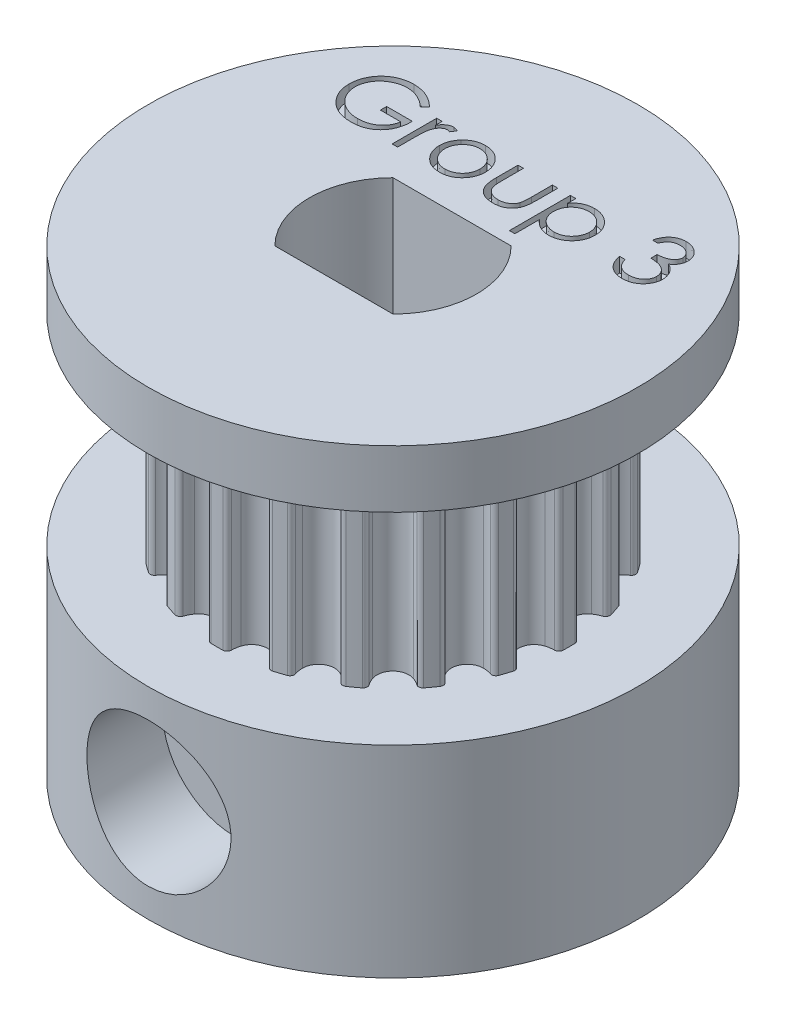
from build123d import *

# Parameters (mm, degrees)
GEAR_DEPTH              = 3.5
SKETCH2_R               = 8.5
BASE_DEPTH              = 7
NUT_PASSTHROUGH_DEPTH   = 4.2
TOP_START               = 2
SKETCH9_R               = 8.5
TOP_DEPTH               = 2
SHAFT_HOLE_DEPTH        = 16.016657418
SKETCH10_R              = 1.4
SCREW_HOLE_DEPTH        = 16.9608897
SCREW_START             = 5.5
SKETCH10_3_R            = 2.5
SKETCH10_3_R_2          = 1.4
SCREW_COUNTERBORE_DEPTH = 11.460889892
CUT_EXTRUDE2_DEPTH      = 0.5


with BuildPart() as part:
    # Sketch1 → Gear (new, symmetric)
    with BuildSketch(Plane(origin=(0, 0, 0), x_dir=(1, 0, 0), z_dir=(0, 1, 0))):
        with BuildLine():
            ThreePointArc((0.83678283, 5.283238861), (0.559451844, 5.412576285), (0.392824337, 5.669239329))
            ThreePointArc((0.392824337, 5.669239329), (0.360319412, 5.812613334), (0.349186496, 5.959203693))
            ThreePointArc((0.349186496, 5.959203693), (0.306893857, 6.063268803), (0.204198113, 6.108785816))
            ThreePointArc((0.204198113, 6.108785816), (0, 6.112197724), (-0.204198113, 6.108785816))
            ThreePointArc((-0.204198113, 6.108785816), (-0.306893857, 6.063268803), (-0.349186496, 5.959203693))
            ThreePointArc((-0.349186496, 5.959203693), (-0.360319412, 5.812613334), (-0.392824337, 5.669239329))
            ThreePointArc((-0.392824337, 5.669239329), (-0.559451844, 5.412576285), (-0.83678283, 5.283238861))
            ThreePointArc((-0.83678283, 5.283238861), (-1.140507733, 5.320546073), (-1.378293153, 5.513156403))
            ThreePointArc((-1.378293153, 5.513156403), (-1.453512177, 5.63946861), (-1.509399121, 5.775444066))
            ThreePointArc((-1.509399121, 5.775444066), (-1.581779699, 5.861346723), (-1.693514686, 5.872901244))
            ThreePointArc((-1.693514686, 5.872901244), (-1.88877297, 5.813045474), (-2.081922578, 5.74669987))
            ThreePointArc((-2.081922578, 5.74669987), (-2.165526505, 5.671675888), (-2.173591307, 5.559634943))
            ThreePointArc((-2.173591307, 5.559634943), (-2.138880426, 5.416778966), (-2.125489443, 5.270377611))
            ThreePointArc((-2.125489443, 5.270377611), (-2.204648378, 4.974785818), (-2.428438357, 4.766078631))
            ThreePointArc((-2.428438357, 4.766078631), (-2.728826467, 4.707703741), (-3.014493705, 4.817407315))
            ThreePointArc((-3.014493705, 4.817407315), (-3.125063867, 4.914293405), (-3.220234237, 5.026343734))
            ThreePointArc((-3.220234237, 5.026343734), (-3.315617637, 5.085675187), (-3.425454468, 5.062136179))
            ThreePointArc((-3.425454468, 5.062136179), (-3.592659681, 4.944871831), (-3.755853956, 4.822086901))
            ThreePointArc((-3.755853956, 4.822086901), (-3.812182329, 4.72489982), (-3.785229856, 4.615850388))
            ThreePointArc((-3.785229856, 4.615850388), (-3.708072922, 4.490712533), (-3.650096834, 4.355614611))
            ThreePointArc((-3.650096834, 4.355614611), (-3.634038567, 4.050028654), (-3.782381417, 3.782381417))
            ThreePointArc((-3.782381417, 3.782381417), (-4.050028654, 3.634038567), (-4.355614611, 3.650096834))
            ThreePointArc((-4.355614611, 3.650096834), (-4.490712533, 3.708072922), (-4.615850388, 3.785229856))
            ThreePointArc((-4.615850388, 3.785229856), (-4.72489982, 3.812182329), (-4.822086901, 3.755853956))
            ThreePointArc((-4.822086901, 3.755853956), (-4.944871831, 3.592659681), (-5.062136179, 3.425454468))
            ThreePointArc((-5.062136179, 3.425454468), (-5.085675187, 3.315617637), (-5.026343734, 3.220234237))
            ThreePointArc((-5.026343734, 3.220234237), (-4.914293405, 3.125063867), (-4.817407315, 3.014493705))
            ThreePointArc((-4.817407315, 3.014493705), (-4.707703741, 2.728826467), (-4.766078631, 2.428438357))
            ThreePointArc((-4.766078631, 2.428438357), (-4.974785818, 2.204648378), (-5.270377611, 2.125489443))
            ThreePointArc((-5.270377611, 2.125489443), (-5.416778966, 2.138880426), (-5.559634943, 2.173591307))
            ThreePointArc((-5.559634943, 2.173591307), (-5.671675888, 2.165526505), (-5.74669987, 2.081922578))
            ThreePointArc((-5.74669987, 2.081922578), (-5.813045474, 1.88877297), (-5.872901244, 1.693514686))
            ThreePointArc((-5.872901244, 1.693514686), (-5.861346723, 1.581779699), (-5.775444066, 1.509399121))
            ThreePointArc((-5.775444066, 1.509399121), (-5.63946861, 1.453512177), (-5.513156403, 1.378293153))
            ThreePointArc((-5.513156403, 1.378293153), (-5.320546073, 1.140507733), (-5.283238861, 0.83678283))
            ThreePointArc((-5.283238861, 0.83678283), (-5.412576285, 0.559451844), (-5.669239329, 0.392824337))
            ThreePointArc((-5.669239329, 0.392824337), (-5.812613334, 0.360319412), (-5.959203693, 0.349186496))
            ThreePointArc((-5.959203693, 0.349186496), (-6.063268803, 0.306893857), (-6.108785816, 0.204198113))
            ThreePointArc((-6.108785816, 0.204198113), (-6.112197724, 0), (-6.108785816, -0.204198113))
            ThreePointArc((-6.108785816, -0.204198113), (-6.063268803, -0.306893857), (-5.959203693, -0.349186496))
            ThreePointArc((-5.959203693, -0.349186496), (-5.812613334, -0.360319412), (-5.669239329, -0.392824337))
            ThreePointArc((-5.669239329, -0.392824337), (-5.412576285, -0.559451844), (-5.283238861, -0.83678283))
            ThreePointArc((-5.283238861, -0.83678283), (-5.320546073, -1.140507733), (-5.513156403, -1.378293153))
            ThreePointArc((-5.513156403, -1.378293153), (-5.63946861, -1.453512177), (-5.775444066, -1.509399121))
            ThreePointArc((-5.775444066, -1.509399121), (-5.861346723, -1.581779699), (-5.872901244, -1.693514686))
            ThreePointArc((-5.872901244, -1.693514686), (-5.813045474, -1.88877297), (-5.74669987, -2.081922578))
            ThreePointArc((-5.74669987, -2.081922578), (-5.671675888, -2.165526505), (-5.559634943, -2.173591307))
            ThreePointArc((-5.559634943, -2.173591307), (-5.416778966, -2.138880426), (-5.270377611, -2.125489443))
            ThreePointArc((-5.270377611, -2.125489443), (-4.974785818, -2.204648378), (-4.766078631, -2.428438357))
            ThreePointArc((-4.766078631, -2.428438357), (-4.707703741, -2.728826467), (-4.817407315, -3.014493705))
            ThreePointArc((-4.817407315, -3.014493705), (-4.914293405, -3.125063867), (-5.026343734, -3.220234237))
            ThreePointArc((-5.026343734, -3.220234237), (-5.085675187, -3.315617637), (-5.062136179, -3.425454468))
            ThreePointArc((-5.062136179, -3.425454468), (-4.944871831, -3.592659681), (-4.822086901, -3.755853956))
            ThreePointArc((-4.822086901, -3.755853956), (-4.72489982, -3.812182329), (-4.615850388, -3.785229856))
            ThreePointArc((-4.615850388, -3.785229856), (-4.490712533, -3.708072922), (-4.355614611, -3.650096834))
            ThreePointArc((-4.355614611, -3.650096834), (-4.050028654, -3.634038567), (-3.782381417, -3.782381417))
            ThreePointArc((-3.782381417, -3.782381417), (-3.634038567, -4.050028654), (-3.650096834, -4.355614611))
            ThreePointArc((-3.650096834, -4.355614611), (-3.708072922, -4.490712533), (-3.785229856, -4.615850388))
            ThreePointArc((-3.785229856, -4.615850388), (-3.812182329, -4.72489982), (-3.755853956, -4.822086901))
            ThreePointArc((-3.755853956, -4.822086901), (-3.592659681, -4.944871831), (-3.425454468, -5.062136179))
            ThreePointArc((-3.425454468, -5.062136179), (-3.315617637, -5.085675187), (-3.220234237, -5.026343734))
            ThreePointArc((-3.220234237, -5.026343734), (-3.125063867, -4.914293405), (-3.014493705, -4.817407315))
            ThreePointArc((-3.014493705, -4.817407315), (-2.728826467, -4.707703741), (-2.428438357, -4.766078631))
            ThreePointArc((-2.428438357, -4.766078631), (-2.204648378, -4.974785818), (-2.125489443, -5.270377611))
            ThreePointArc((-2.125489443, -5.270377611), (-2.138880426, -5.416778966), (-2.173591307, -5.559634943))
            ThreePointArc((-2.173591307, -5.559634943), (-2.165526505, -5.671675888), (-2.081922578, -5.74669987))
            ThreePointArc((-2.081922578, -5.74669987), (-1.88877297, -5.813045474), (-1.693514686, -5.872901244))
            ThreePointArc((-1.693514686, -5.872901244), (-1.581779699, -5.861346723), (-1.509399121, -5.775444066))
            ThreePointArc((-1.509399121, -5.775444066), (-1.453512177, -5.63946861), (-1.378293153, -5.513156403))
            ThreePointArc((-1.378293153, -5.513156403), (-1.140507733, -5.320546073), (-0.83678283, -5.283238861))
            ThreePointArc((-0.83678283, -5.283238861), (-0.559451844, -5.412576285), (-0.392824337, -5.669239329))
            ThreePointArc((-0.392824337, -5.669239329), (-0.360319412, -5.812613334), (-0.349186496, -5.959203693))
            ThreePointArc((-0.349186496, -5.959203693), (-0.306893857, -6.063268803), (-0.204198113, -6.108785816))
            ThreePointArc((-0.204198113, -6.108785816), (0, -6.112197724), (0.204198113, -6.108785816))
            ThreePointArc((0.204198113, -6.108785816), (0.306893857, -6.063268803), (0.349186496, -5.959203693))
            ThreePointArc((0.349186496, -5.959203693), (0.360319412, -5.812613334), (0.392824337, -5.669239329))
            ThreePointArc((0.392824337, -5.669239329), (0.559451844, -5.412576285), (0.83678283, -5.283238861))
            ThreePointArc((0.83678283, -5.283238861), (1.140507733, -5.320546073), (1.378293153, -5.513156403))
            ThreePointArc((1.378293153, -5.513156403), (1.453512177, -5.63946861), (1.509399121, -5.775444066))
            ThreePointArc((1.509399121, -5.775444066), (1.581779699, -5.861346723), (1.693514686, -5.872901244))
            ThreePointArc((1.693514686, -5.872901244), (1.88877297, -5.813045474), (2.081922578, -5.74669987))
            ThreePointArc((2.081922578, -5.74669987), (2.165526505, -5.671675888), (2.173591307, -5.559634943))
            ThreePointArc((2.173591307, -5.559634943), (2.138880426, -5.416778966), (2.125489443, -5.270377611))
            ThreePointArc((2.125489443, -5.270377611), (2.204648378, -4.974785818), (2.428438357, -4.766078631))
            ThreePointArc((2.428438357, -4.766078631), (2.728826467, -4.707703741), (3.014493705, -4.817407315))
            ThreePointArc((3.014493705, -4.817407315), (3.125063867, -4.914293405), (3.220234237, -5.026343734))
            ThreePointArc((3.220234237, -5.026343734), (3.315617637, -5.085675187), (3.425454468, -5.062136179))
            ThreePointArc((3.425454468, -5.062136179), (3.592659681, -4.944871831), (3.755853956, -4.822086901))
            ThreePointArc((3.755853956, -4.822086901), (3.812182329, -4.72489982), (3.785229856, -4.615850388))
            ThreePointArc((3.785229856, -4.615850388), (3.708072922, -4.490712533), (3.650096834, -4.355614611))
            ThreePointArc((3.650096834, -4.355614611), (3.634038567, -4.050028654), (3.782381417, -3.782381417))
            ThreePointArc((3.782381417, -3.782381417), (4.050028654, -3.634038567), (4.355614611, -3.650096834))
            ThreePointArc((4.355614611, -3.650096834), (4.490712533, -3.708072922), (4.615850388, -3.785229856))
            ThreePointArc((4.615850388, -3.785229856), (4.72489982, -3.812182329), (4.822086901, -3.755853956))
            ThreePointArc((4.822086901, -3.755853956), (4.944871831, -3.592659681), (5.062136179, -3.425454468))
            ThreePointArc((5.062136179, -3.425454468), (5.085675187, -3.315617637), (5.026343734, -3.220234237))
            ThreePointArc((5.026343734, -3.220234237), (4.914293405, -3.125063867), (4.817407315, -3.014493705))
            ThreePointArc((4.817407315, -3.014493705), (4.707703741, -2.728826467), (4.766078631, -2.428438357))
            ThreePointArc((4.766078631, -2.428438357), (4.974785818, -2.204648378), (5.270377611, -2.125489443))
            ThreePointArc((5.270377611, -2.125489443), (5.416778966, -2.138880426), (5.559634943, -2.173591307))
            ThreePointArc((5.559634943, -2.173591307), (5.671675888, -2.165526505), (5.74669987, -2.081922578))
            ThreePointArc((5.74669987, -2.081922578), (5.813045474, -1.88877297), (5.872901244, -1.693514686))
            ThreePointArc((5.872901244, -1.693514686), (5.861346723, -1.581779699), (5.775444066, -1.509399121))
            ThreePointArc((5.775444066, -1.509399121), (5.63946861, -1.453512177), (5.513156403, -1.378293153))
            ThreePointArc((5.513156403, -1.378293153), (5.320546073, -1.140507733), (5.283238861, -0.83678283))
            ThreePointArc((5.283238861, -0.83678283), (5.412576285, -0.559451844), (5.669239329, -0.392824337))
            ThreePointArc((5.669239329, -0.392824337), (5.812613334, -0.360319412), (5.959203693, -0.349186496))
            ThreePointArc((5.959203693, -0.349186496), (6.063268803, -0.306893857), (6.108785816, -0.204198113))
            ThreePointArc((6.108785816, -0.204198113), (6.112197724, 0), (6.108785816, 0.204198113))
            ThreePointArc((6.108785816, 0.204198113), (6.063268803, 0.306893857), (5.959203693, 0.349186496))
            ThreePointArc((5.959203693, 0.349186496), (5.812613334, 0.360319412), (5.669239329, 0.392824337))
            ThreePointArc((5.669239329, 0.392824337), (5.412576285, 0.559451844), (5.283238861, 0.83678283))
            ThreePointArc((5.283238861, 0.83678283), (5.320546073, 1.140507733), (5.513156403, 1.378293153))
            ThreePointArc((5.513156403, 1.378293153), (5.63946861, 1.453512177), (5.775444066, 1.509399121))
            ThreePointArc((5.775444066, 1.509399121), (5.861346723, 1.581779699), (5.872901244, 1.693514686))
            ThreePointArc((5.872901244, 1.693514686), (5.813045474, 1.88877297), (5.74669987, 2.081922578))
            ThreePointArc((5.74669987, 2.081922578), (5.671675888, 2.165526505), (5.559634943, 2.173591307))
            ThreePointArc((5.559634943, 2.173591307), (5.416778966, 2.138880426), (5.270377611, 2.125489443))
            ThreePointArc((5.270377611, 2.125489443), (4.974785818, 2.204648378), (4.766078631, 2.428438357))
            ThreePointArc((4.766078631, 2.428438357), (4.707703741, 2.728826467), (4.817407315, 3.014493705))
            ThreePointArc((4.817407315, 3.014493705), (4.914293405, 3.125063867), (5.026343734, 3.220234237))
            ThreePointArc((5.026343734, 3.220234237), (5.085675187, 3.315617637), (5.062136179, 3.425454468))
            ThreePointArc((5.062136179, 3.425454468), (4.944871831, 3.592659681), (4.822086901, 3.755853956))
            ThreePointArc((4.822086901, 3.755853956), (4.72489982, 3.812182329), (4.615850388, 3.785229856))
            ThreePointArc((4.615850388, 3.785229856), (4.490712533, 3.708072922), (4.355614611, 3.650096834))
            ThreePointArc((4.355614611, 3.650096834), (4.050028654, 3.634038567), (3.782381417, 3.782381417))
            ThreePointArc((3.782381417, 3.782381417), (3.634038567, 4.050028654), (3.650096834, 4.355614611))
            ThreePointArc((3.650096834, 4.355614611), (3.708072922, 4.490712533), (3.785229856, 4.615850388))
            ThreePointArc((3.785229856, 4.615850388), (3.812182329, 4.72489982), (3.755853956, 4.822086901))
            ThreePointArc((3.755853956, 4.822086901), (3.592659681, 4.944871831), (3.425454468, 5.062136179))
            ThreePointArc((3.425454468, 5.062136179), (3.315617637, 5.085675187), (3.220234237, 5.026343734))
            ThreePointArc((3.220234237, 5.026343734), (3.125063867, 4.914293405), (3.014493705, 4.817407315))
            ThreePointArc((3.014493705, 4.817407315), (2.728826467, 4.707703741), (2.428438357, 4.766078631))
            ThreePointArc((2.428438357, 4.766078631), (2.204648378, 4.974785818), (2.125489443, 5.270377611))
            ThreePointArc((2.125489443, 5.270377611), (2.138880426, 5.416778966), (2.173591307, 5.559634943))
            ThreePointArc((2.173591307, 5.559634943), (2.165526505, 5.671675888), (2.081922578, 5.74669987))
            ThreePointArc((2.081922578, 5.74669987), (1.88877297, 5.813045474), (1.693514686, 5.872901244))
            ThreePointArc((1.693514686, 5.872901244), (1.581779699, 5.861346723), (1.509399121, 5.775444066))
            ThreePointArc((1.509399121, 5.775444066), (1.453512177, 5.63946861), (1.378293153, 5.513156403))
            ThreePointArc((1.378293153, 5.513156403), (1.140507733, 5.320546073), (0.83678283, 5.283238861))
        make_face()
    extrude(amount=GEAR_DEPTH, both=True)

    # Sketch2 → Base (add)
    with BuildSketch(Plane.XZ.offset(3.5)):
        Circle(SKETCH2_R)
        with BuildLine():
            ThreePointArc((2.05121915, 2.05), (2.9, 0), (2.05121915, -2.05))
            Line((2.05121915, -2.05), (-2.05121915, -2.05))
            ThreePointArc((-2.05121915, -2.05), (-2.9, 0), (-2.05121915, 2.05))
            Line((-2.05121915, 2.05), (2.05121915, 2.05))
        make_face(mode=Mode.SUBTRACT)
    extrude(amount=BASE_DEPTH)

    # Sketch3 → Nut Passthrough (cut)
    with BuildSketch(Plane.XY):
        Polygon((-2.65, -5.470021787), (-2.65, -10.5), (2.65, -10.5), (2.65, -5.470021787), (0, -3.940043573), align=None)
    extrude(amount=NUT_PASSTHROUGH_DEPTH, mode=Mode.SUBTRACT)

    # Sketch9 → Top (add)
    with BuildSketch(Plane(origin=(0, 3.5, 0), x_dir=(1, 0, 0), z_dir=(0, 1, 0)).offset(TOP_START)):
        Circle(SKETCH9_R)
    extrude(amount=-TOP_DEPTH)

    # Sketch2<4> → Shaft Hole (cut, through all)
    with BuildSketch(Plane.XZ.offset(3.5)):
        with BuildLine():
            ThreePointArc((-2.05121915, 2.05), (-2.9, 0), (-2.05121915, -2.05))
            Line((-2.05121915, -2.05), (2.05121915, -2.05))
            ThreePointArc((2.05121915, -2.05), (2.9, 0), (2.05121915, 2.05))
            Line((2.05121915, 2.05), (-2.05121915, 2.05))
        make_face()
    extrude(amount=-SHAFT_HOLE_DEPTH, mode=Mode.SUBTRACT)

    # Sketch10 → Screw Hole (cut, through all)
    with BuildSketch(Plane.XY):
        with Locations((0, -7)):
            Circle(SKETCH10_R)
    extrude(amount=SCREW_HOLE_DEPTH, mode=Mode.SUBTRACT)

    # Sketch10<3> → Screw Counterbore (cut, through all)
    with BuildSketch(Plane.XY.offset(SCREW_START)):
        with Locations((0, -7)):
            Circle(SKETCH10_3_R)
        with Locations((0, -7)):
            Circle(SKETCH10_3_R_2, mode=Mode.SUBTRACT)
    extrude(amount=SCREW_COUNTERBORE_DEPTH, mode=Mode.SUBTRACT)

    # Sketch20 → Cut-Extrude2 (cut)
    # profile 1 of 6: a face of its own
    with BuildSketch(Plane(origin=(0, 5.5, 0), x_dir=(1, 0, 0), z_dir=(0, 1, 0))):
        with BuildLine():
            Line((-3.541346154, 4.805408654), (-3.704166667, 4.651068376))
            add(Edge.make_bspline(
                [(-3.704166667, 4.651068376), (-3.733629994, 4.678785136), (-3.79185408, 4.733557734), (-3.886777655, 4.804623907), (-3.985815662, 4.86550293), (-4.088451315, 4.915036701), (-4.192142917, 4.954559561), (-4.295514129, 4.982698008), (-4.397504624, 5.000642828), (-4.465339085, 5.002788747), (-4.49876469, 5.003846154)],
                knots=[0, 0, 0, 0, 1.08915593, 2.152340314, 3.188132944, 4.216796309, 5.218260357, 6.173443236, 7.099959455, 8, 8, 8, 8], degree=3))
            add(Edge.make_bspline(
                [(-4.49876469, 5.003846154), (-4.519275009, 5.003596021), (-4.560242451, 5.003096403), (-4.62109477, 4.996719664), (-4.681308879, 4.987548532), (-4.74077111, 4.97427892), (-4.799597079, 4.95746106), (-4.85758219, 4.936424137), (-4.914834609, 4.91189787), (-4.970815049, 4.883557231), (-5.025086686, 4.852424181), (-5.076344392, 4.817923397), (-5.124914876, 4.781160653), (-5.169885228, 4.741215537), (-5.211514127, 4.69844988), (-5.250792428, 4.653659214), (-5.286338697, 4.60561982), (-5.318446212, 4.55521556), (-5.347088714, 4.503331713), (-5.372372995, 4.450467666), (-5.393598377, 4.396798764), (-5.410392286, 4.34225766), (-5.424247776, 4.287266303), (-5.433995091, 4.231443925), (-5.439490394, 4.174730753), (-5.440440947, 4.136753363), (-5.440918803, 4.117661592)],
                knots=[0, 0, 0, 0, 1.02818874, 2.053710826, 3.065248034, 4.081641283, 5.106893873, 6.131558223, 7.173050175, 8.228653731, 9.27666206, 10.308777013, 11.325269123, 12.329503258, 13.32196095, 14.316845687, 15.314881793, 16.315733098, 17.311955233, 18.285320748, 19.252783886, 20.203351036, 21.145449891, 22.095197417, 23.042428769, 24, 24, 24, 24], degree=3))
            add(Edge.make_bspline(
                [(-5.440918803, 4.117661592), (-5.440461774, 4.098145431), (-5.439548963, 4.059166401), (-5.433706769, 4.000991891), (-5.422864452, 3.943681386), (-5.408369695, 3.887046562), (-5.39023844, 3.830990427), (-5.367636875, 3.775756004), (-5.340866726, 3.721345339), (-5.309880812, 3.668248685), (-5.275901536, 3.616527618), (-5.237835959, 3.567808288), (-5.197401225, 3.521441933), (-5.153124247, 3.478458018), (-5.10642481, 3.437706805), (-5.055907671, 3.400311037), (-5.002566183, 3.365550397), (-4.946318965, 3.333862978), (-4.88777633, 3.305554959), (-4.827749627, 3.280382412), (-4.766047091, 3.259651575), (-4.702992988, 3.242755674), (-4.638662485, 3.228906447), (-4.572729043, 3.219996804), (-4.505677453, 3.213531396), (-4.460478375, 3.213058672), (-4.437706998, 3.212820513)],
                knots=[0, 0, 0, 0, 0.93586088, 1.869166235, 2.799637598, 3.729985548, 4.670839027, 5.622275134, 6.589130586, 7.576015415, 8.568469353, 9.55398029, 10.53834874, 11.515998671, 12.510579167, 13.508179873, 14.527009472, 15.561807829, 16.601455013, 17.643573243, 18.680854198, 19.719860599, 20.772568776, 21.833555941, 22.908541556, 24, 24, 24, 24], degree=3))
            add(Edge.make_bspline(
                [(-4.437706998, 3.212820513), (-4.410263902, 3.213394176), (-4.356374925, 3.214520656), (-4.277159315, 3.223289878), (-4.20107841, 3.236985796), (-4.128345992, 3.257043267), (-4.058877584, 3.282626918), (-3.992418519, 3.313466985), (-3.92949204, 3.350746359), (-3.869908978, 3.392821984), (-3.81502249, 3.439700001), (-3.765520234, 3.490284981), (-3.722191771, 3.544331384), (-3.68439131, 3.601520884), (-3.653119886, 3.662326854), (-3.6274521, 3.726451308), (-3.607777205, 3.793923089), (-3.599700625, 3.840545172), (-3.595619658, 3.864102564)],
                knots=[0, 0, 0, 0, 1.13008108, 2.219097802, 3.278683437, 4.311054135, 5.322181354, 6.324827112, 7.324222904, 8.330512327, 9.32562643, 10.293043162, 11.24128371, 12.174520618, 13.111833804, 14.052305215, 15.015860969, 16, 16, 16, 16], degree=3))
            Line((-3.595619658, 3.864102564), (-4.301175214, 3.864102564))
            Line((-4.301175214, 3.864102564), (-4.301175214, 4.081196581))
            Line((-4.301175214, 4.081196581), (-3.405662393, 4.081196581))
            add(Edge.make_bspline(
                [(-3.405662393, 4.081196581), (-3.406694025, 4.040733481), (-3.408713116, 3.961539884), (-3.422875984, 3.846048339), (-3.44574597, 3.736966411), (-3.476988158, 3.63417922), (-3.51743178, 3.537832428), (-3.566642786, 3.447828214), (-3.625408783, 3.36474803), (-3.691636526, 3.287913633), (-3.765961738, 3.219376443), (-3.846376094, 3.159138566), (-3.933012451, 3.10839746), (-4.025788859, 3.067116012), (-4.124401597, 3.03489793), (-4.229078855, 3.012055119), (-4.33967868, 2.998369379), (-4.415477528, 2.996620783), (-4.454243456, 2.995726496)],
                knots=[0, 0, 0, 0, 1.140356446, 2.231883559, 3.274166699, 4.278491846, 5.25512956, 6.21435461, 7.1637429, 8.11826594, 9.068280886, 10.0076534, 10.945064095, 11.891975133, 12.864533718, 13.863980011, 14.907571808, 16, 16, 16, 16], degree=3))
            add(Edge.make_bspline(
                [(-4.454243456, 2.995726496), (-4.478137681, 2.996070679), (-4.525264793, 2.996749518), (-4.594867402, 3.001573914), (-4.662550915, 3.009000739), (-4.728305473, 3.020216123), (-4.792372947, 3.03395308), (-4.854433362, 3.05154362), (-4.91472313, 3.071905167), (-4.973335436, 3.095064931), (-5.029738281, 3.121899219), (-5.084182889, 3.15171981), (-5.136970212, 3.184372938), (-5.187740679, 3.220423306), (-5.236758821, 3.25960127), (-5.28370857, 3.301985355), (-5.328852763, 3.347445984), (-5.35713171, 3.379727576), (-5.371380876, 3.39599359)],
                knots=[0, 0, 0, 0, 1.107784379, 2.184907829, 3.233506516, 4.263428166, 5.276301166, 6.270063455, 7.25232949, 8.225834625, 9.190232166, 10.146266622, 11.1027726, 12.066435141, 13.031522626, 14.010570082, 14.99756817, 16, 16, 16, 16], degree=3))
            add(Edge.make_bspline(
                [(-5.371380876, 3.39599359), (-5.392055225, 3.421799175), (-5.433060751, 3.472982), (-5.485843255, 3.55498768), (-5.530838389, 3.639897377), (-5.567346549, 3.727947462), (-5.595853867, 3.819055576), (-5.616298601, 3.9131053), (-5.628277295, 4.010217743), (-5.630003006, 4.075934355), (-5.630876068, 4.109181357)],
                knots=[0, 0, 0, 0, 1.023165419, 2.029347347, 3.013907458, 3.994755782, 4.975994455, 5.96558838, 6.970761222, 8, 8, 8, 8], degree=3))
            add(Edge.make_bspline(
                [(-5.630876068, 4.109181357), (-5.630554191, 4.134077138), (-5.629914527, 4.183552291), (-5.622158144, 4.257005043), (-5.611029667, 4.329153557), (-5.594672639, 4.399938856), (-5.574052517, 4.469408213), (-5.54831779, 4.537593887), (-5.518354924, 4.604536114), (-5.48352941, 4.66977412), (-5.44477357, 4.732442217), (-5.402712246, 4.792288127), (-5.356748164, 4.84822199), (-5.307631942, 4.900952177), (-5.254777572, 4.949816242), (-5.198680206, 4.995266585), (-5.139296613, 5.037364173), (-5.076439971, 5.075445931), (-5.011048467, 5.109653453), (-4.943278847, 5.13964312), (-4.873151799, 5.164428268), (-4.801192705, 5.185458125), (-4.726856883, 5.201009662), (-4.650683773, 5.212287713), (-4.572276324, 5.220004837), (-4.519277392, 5.220625478), (-4.492404514, 5.220940171)],
                knots=[0, 0, 0, 0, 1.008945113, 2.00506715, 2.99143336, 3.967273523, 4.948097931, 5.927297278, 6.919902385, 7.919676788, 8.923139349, 9.905703106, 10.883022732, 11.856032218, 12.825136022, 13.798837087, 14.781400844, 15.773989409, 16.776158564, 17.77167057, 18.775803737, 19.789618931, 20.80898985, 21.851988756, 22.910860228, 24, 24, 24, 24], degree=3))
            add(Edge.make_bspline(
                [(-4.492404514, 5.220940171), (-4.470489005, 5.220589716), (-4.427033125, 5.219894806), (-4.362368516, 5.215078091), (-4.298703407, 5.207443648), (-4.235943399, 5.197025544), (-4.174302216, 5.182835598), (-4.113604256, 5.165854921), (-4.053761532, 5.146084152), (-3.994961591, 5.122505183), (-3.936809067, 5.095742276), (-3.878980621, 5.065617016), (-3.821673839, 5.031614275), (-3.76478934, 4.99363309), (-3.707968417, 4.952325784), (-3.6521098, 4.906510943), (-3.595865162, 4.857995277), (-3.559699303, 4.823111289), (-3.541346154, 4.805408654)],
                knots=[0, 0, 0, 0, 0.985871117, 1.954866573, 2.915460327, 3.869826059, 4.81536089, 5.759505086, 6.70452669, 7.649098992, 8.607881297, 9.583363685, 10.581137262, 11.603961102, 12.659522466, 13.73993555, 14.853081303, 16, 16, 16, 16], degree=3))
        make_face()
    # profile 2 of 6: a face of its own
    with BuildSketch(Plane(origin=(0, 5.5, 0), x_dir=(1, 0, 0), z_dir=(0, 1, 0))):
        with BuildLine():
            Line((-3.080021368, 4.596794872), (-2.890064103, 4.596794872))
            Line((-2.890064103, 4.596794872), (-2.890064103, 4.369100561))
            add(Edge.make_bspline(
                [(-2.890064103, 4.369100561), (-2.876040425, 4.39030099), (-2.84922025, 4.430846647), (-2.804641478, 4.484470462), (-2.75897994, 4.528869086), (-2.712017041, 4.564249785), (-2.663407428, 4.590746291), (-2.614217938, 4.610154936), (-2.563674678, 4.621631693), (-2.529710085, 4.623163953), (-2.512693643, 4.623931624)],
                knots=[0, 0, 0, 0, 1.2804753, 2.448899062, 3.506932113, 4.484331642, 5.4025378, 6.288909075, 7.142734305, 8, 8, 8, 8], degree=3))
            add(Edge.make_bspline(
                [(-2.512693643, 4.623931624), (-2.499493912, 4.623211639), (-2.472334608, 4.621730223), (-2.431221328, 4.611321772), (-2.388861717, 4.59470411), (-2.36156132, 4.579076928), (-2.34732906, 4.570930155)],
                knots=[0, 0, 0, 0, 0.901110191, 1.854092781, 2.881294221, 4, 4, 4, 4], degree=3))
            Line((-2.34732906, 4.570930155), (-2.451635951, 4.406413595))
            add(Edge.make_bspline(
                [(-2.451635951, 4.406413595), (-2.460773311, 4.410489851), (-2.478117771, 4.418227366), (-2.503490294, 4.427384677), (-2.526883293, 4.432776683), (-2.541786778, 4.433593545), (-2.548734642, 4.433974359)],
                knots=[0, 0, 0, 0, 1.180555205, 2.24091978, 3.179933427, 4, 4, 4, 4], degree=3))
            add(Edge.make_bspline(
                [(-2.548734642, 4.433974359), (-2.56397811, 4.432958336), (-2.595070364, 4.430885945), (-2.640720514, 4.41459438), (-2.685017634, 4.388271973), (-2.720197639, 4.359079443), (-2.747437478, 4.330929109), (-2.766874662, 4.306346503), (-2.784704704, 4.278782283), (-2.80174098, 4.248707665), (-2.817262977, 4.215609139), (-2.831749848, 4.179817386), (-2.844848303, 4.141290951), (-2.852317261, 4.114450094), (-2.856143162, 4.100701122)],
                knots=[0, 0, 0, 0, 1.125678352, 2.296057538, 3.5422874, 4.923748041, 5.663163013, 6.437101912, 7.23742474, 8.08941207, 8.991984279, 9.93940061, 10.944477711, 12, 12, 12, 12], degree=3))
            add(Edge.make_bspline(
                [(-2.856143162, 4.100701122), (-2.859005134, 4.08843826), (-2.865344182, 4.061276952), (-2.871507636, 4.015709035), (-2.877597297, 3.961870917), (-2.881889062, 3.89961274), (-2.885867211, 3.829089976), (-2.888110927, 3.75019519), (-2.889987588, 3.662847401), (-2.890037824, 3.601781959), (-2.890064103, 3.569838408)],
                knots=[0, 0, 0, 0, 0.566838948, 1.255505196, 2.06880316, 3.007127437, 4.065329342, 5.249902469, 6.561414163, 8, 8, 8, 8], degree=3))
            Line((-2.890064103, 3.569838408), (-2.890064103, 3.05))
            Line((-2.890064103, 3.05), (-3.080021368, 3.05))
            Line((-3.080021368, 3.05), (-3.080021368, 4.596794872))
        make_face()
    # profile 3 of 6: a face of its own
    with BuildSketch(Plane(origin=(0, 5.5, 0), x_dir=(1, 0, 0), z_dir=(0, 1, 0))):
        with BuildLine():
            add(Edge.make_bspline(
                [(-1.410263088, 4.623931624), (-1.381239794, 4.623313623), (-1.324332208, 4.622101875), (-1.240991249, 4.609150919), (-1.161437762, 4.589346561), (-1.085367065, 4.561968045), (-1.0137534, 4.525269913), (-0.945553648, 4.481479532), (-0.88095479, 4.429601487), (-0.842236101, 4.389470655), (-0.822582799, 4.369100561)],
                knots=[0, 0, 0, 0, 1.054011418, 2.066658804, 3.057071809, 4.030435133, 4.997543892, 5.974964718, 6.972108034, 8, 8, 8, 8], degree=3))
            add(Edge.make_bspline(
                [(-0.822582799, 4.369100561), (-0.805660379, 4.349618769), (-0.772143035, 4.311032213), (-0.729165196, 4.248466199), (-0.692140728, 4.183671948), (-0.662469319, 4.115789041), (-0.63907409, 4.045410073), (-0.622463883, 3.972293143), (-0.612583927, 3.896599723), (-0.611251657, 3.84519264), (-0.610576923, 3.819157318)],
                knots=[0, 0, 0, 0, 1.025258237, 2.030674902, 3.01204498, 3.988269485, 4.97094183, 5.956517959, 6.965070386, 8, 8, 8, 8], degree=3))
            add(Edge.make_bspline(
                [(-0.610576923, 3.819157318), (-0.611170399, 3.792971093), (-0.612343134, 3.74122589), (-0.623436654, 3.665014179), (-0.640691168, 3.591115405), (-0.665384708, 3.519838957), (-0.697048898, 3.450966961), (-0.735687552, 3.384800234), (-0.781571816, 3.321208229), (-0.833583756, 3.260730927), (-0.89106751, 3.204992312), (-0.953428228, 3.156412834), (-1.01944043, 3.114792198), (-1.089981886, 3.081266366), (-1.164408414, 3.054832404), (-1.242880546, 3.036266204), (-1.325276374, 3.025040805), (-1.381535694, 3.02359931), (-1.410263088, 3.022863248)],
                knots=[0, 0, 0, 0, 0.998656419, 1.973391657, 2.932242238, 3.890759089, 4.846373663, 5.82037756, 6.809684879, 7.83454468, 8.860553229, 9.859544525, 10.845671541, 11.83227036, 12.833544569, 13.85385346, 14.904124723, 16, 16, 16, 16], degree=3))
            add(Edge.make_bspline(
                [(-1.410263088, 3.022863248), (-1.439131228, 3.023601781), (-1.495670938, 3.025048235), (-1.578357603, 3.036222592), (-1.656970373, 3.054823848), (-1.731494335, 3.081353236), (-1.802339075, 3.11479327), (-1.868733766, 3.156287006), (-1.931145144, 3.205006719), (-1.988641058, 3.260727024), (-2.040649739, 3.321209235), (-2.086534844, 3.384799973), (-2.125173279, 3.450967029), (-2.156837526, 3.519838939), (-2.181531051, 3.59111541), (-2.198785569, 3.665014177), (-2.209879088, 3.741225891), (-2.211051824, 3.792971093), (-2.211645299, 3.819157318)],
                knots=[0, 0, 0, 0, 1.099876186, 2.154163076, 3.173186993, 4.173200201, 5.163417411, 6.152872554, 7.150605724, 8.17532212, 9.198891216, 10.186952605, 11.159729845, 12.11414092, 13.071450619, 14.029093627, 15.002601286, 16, 16, 16, 16], degree=3))
            add(Edge.make_bspline(
                [(-2.211645299, 3.819157318), (-2.210965964, 3.845051134), (-2.209620997, 3.896316439), (-2.199750975, 3.971867567), (-2.183205562, 4.04486075), (-2.159782289, 4.114968061), (-2.129837388, 4.182553492), (-2.09333318, 4.247507842), (-2.04991694, 4.30979094), (-2.016532903, 4.348327627), (-1.999639423, 4.367828526)],
                knots=[0, 0, 0, 0, 1.031353054, 2.041901799, 3.029428768, 4.008703097, 4.981709435, 5.96992636, 6.972712378, 8, 8, 8, 8], degree=3))
            add(Edge.make_bspline(
                [(-1.999639423, 4.367828526), (-1.980015751, 4.388375275), (-1.941422348, 4.428784072), (-1.876501927, 4.480510884), (-1.808469949, 4.52521251), (-1.736064875, 4.561181459), (-1.66005667, 4.58950761), (-1.580095509, 4.609201993), (-1.496471745, 4.622055213), (-1.439285689, 4.62329992), (-1.410263088, 4.623931624)],
                knots=[0, 0, 0, 0, 1.027980169, 2.021703884, 2.998553061, 3.971491411, 4.943284454, 5.930300938, 6.949603206, 8, 8, 8, 8], degree=3))
        make_face()
        with BuildLine():
            add(Edge.make_bspline(
                [(-1.411111111, 4.433974359), (-1.431635286, 4.433391011), (-1.472153806, 4.432239373), (-1.531795174, 4.423480059), (-1.589211362, 4.409602283), (-1.644511302, 4.389884592), (-1.697508506, 4.364424782), (-1.748253716, 4.333153535), (-1.796896191, 4.296485033), (-1.842484392, 4.254476655), (-1.884323219, 4.20858793), (-1.920897995, 4.159693923), (-1.95199794, 4.108587704), (-1.977906036, 4.055216128), (-1.997202288, 3.999038335), (-2.011216449, 3.940690525), (-2.019967499, 3.880053821), (-2.021108309, 3.838832633), (-2.021688034, 3.817885283)],
                knots=[0, 0, 0, 0, 1.021534396, 2.016698045, 2.994645724, 3.958388632, 4.93408049, 5.916473867, 6.921342795, 7.962252576, 8.998418191, 10.008913653, 10.997312074, 11.973003931, 12.956656626, 13.948281152, 14.957379055, 16, 16, 16, 16], degree=3))
            add(Edge.make_bspline(
                [(-2.021688034, 3.817885283), (-2.020716288, 3.790820962), (-2.018787555, 3.737103345), (-2.003102912, 3.657993762), (-1.976864543, 3.582046641), (-1.941433188, 3.509707208), (-1.897039903, 3.44277683), (-1.84473582, 3.383104076), (-1.785082287, 3.331586942), (-1.718790403, 3.288841859), (-1.647214221, 3.254878578), (-1.571463969, 3.230809674), (-1.492457454, 3.21516346), (-1.438463869, 3.21360833), (-1.411111111, 3.212820513)],
                knots=[0, 0, 0, 0, 1.016792936, 2.018143844, 3.017858371, 4.030088057, 5.03801393, 6.028138512, 7.003788237, 7.991172063, 8.984598303, 9.972568034, 10.972917682, 12, 12, 12, 12], degree=3))
            add(Edge.make_bspline(
                [(-1.411111111, 3.212820513), (-1.383759926, 3.21361292), (-1.329769447, 3.215177111), (-1.250872706, 3.230730873), (-1.175329495, 3.25498404), (-1.103827656, 3.288803662), (-1.037565948, 3.331749265), (-0.977483384, 3.382813169), (-0.925625891, 3.442934879), (-0.88127652, 3.509795861), (-0.845264918, 3.581934493), (-0.819149363, 3.658007779), (-0.803427014, 3.737099775), (-0.80150337, 3.790819766), (-0.800534188, 3.817885283)],
                knots=[0, 0, 0, 0, 1.02726834, 2.027799167, 3.010890988, 4.004497153, 4.992059811, 5.971914811, 6.958719428, 7.966827853, 8.981595046, 9.981490638, 10.983022906, 12, 12, 12, 12], degree=3))
            add(Edge.make_bspline(
                [(-0.800534188, 3.817885283), (-0.801113713, 3.838832758), (-0.80225413, 3.880054192), (-0.811008037, 3.940689105), (-0.825011626, 3.999043546), (-0.844346842, 4.055196901), (-0.870142364, 4.108725891), (-0.901842044, 4.159543869), (-0.938267474, 4.208757304), (-0.980611161, 4.254328315), (-1.026151775, 4.296501409), (-1.074813965, 4.333167754), (-1.125483928, 4.364287348), (-1.178327166, 4.39010236), (-1.233634195, 4.409422894), (-1.290969936, 4.42356019), (-1.350356835, 4.432202357), (-1.390730161, 4.433379914), (-1.411111111, 4.433974359)],
                knots=[0, 0, 0, 0, 1.042956736, 2.052379634, 3.044323526, 4.02829302, 5.004299113, 5.996692471, 7.007513377, 8.048758398, 9.090003419, 10.095195979, 11.07790575, 12.047570684, 13.018257071, 13.989683339, 14.985167495, 16, 16, 16, 16], degree=3))
        make_face(mode=Mode.SUBTRACT)
    # profile 4 of 6: a face of its own
    with BuildSketch(Plane(origin=(0, 5.5, 0), x_dir=(1, 0, 0), z_dir=(0, 1, 0))):
        with BuildLine():
            Line((-0.257799145, 4.596794872), (-0.06784188, 4.596794872))
            Line((-0.06784188, 4.596794872), (-0.06784188, 3.879366987))
            add(Edge.make_bspline(
                [(-0.06784188, 3.879366987), (-0.067756062, 3.858307515), (-0.067591895, 3.818021731), (-0.066478564, 3.760052166), (-0.063859888, 3.707185868), (-0.060585813, 3.659392299), (-0.056375378, 3.616679543), (-0.051365918, 3.579196789), (-0.045766777, 3.546518973), (-0.040285993, 3.526837991), (-0.037737046, 3.517684963)],
                knots=[0, 0, 0, 0, 1.388932606, 2.656963016, 3.823490214, 4.879454478, 5.816252168, 6.653371382, 7.373723809, 8, 8, 8, 8], degree=3))
            add(Edge.make_bspline(
                [(-0.037737046, 3.517684963), (-0.033647976, 3.506180655), (-0.025554845, 3.483411211), (-0.010875167, 3.450518813), (0.007284827, 3.420053761), (0.027157199, 3.390841298), (0.050077317, 3.363746763), (0.075755187, 3.338815911), (0.103331264, 3.31510677), (0.144306921, 3.287055015), (0.200343715, 3.256989077), (0.273914667, 3.23104732), (0.353685318, 3.215543753), (0.408818268, 3.213745037), (0.437156116, 3.212820513)],
                knots=[0, 0, 0, 0, 0.725840625, 1.436591201, 2.137033971, 2.831655856, 3.53531722, 4.242432219, 4.957935707, 5.694543706, 7.190802206, 8.724350549, 10.316345118, 12, 12, 12, 12], degree=3))
            add(Edge.make_bspline(
                [(0.437156116, 3.212820513), (0.465491333, 3.213764696), (0.520314734, 3.215591517), (0.59920893, 3.230579657), (0.671327643, 3.255620241), (0.735947027, 3.290579961), (0.792773988, 3.333362066), (0.840129517, 3.383562631), (0.879201524, 3.439593451), (0.896261507, 3.481397181), (0.904841079, 3.50242054)],
                knots=[0, 0, 0, 0, 1.157059328, 2.238695713, 3.266970494, 4.264342957, 5.228770407, 6.160125903, 7.074715775, 8, 8, 8, 8], degree=3))
            add(Edge.make_bspline(
                [(0.904841079, 3.50242054), (0.90737759, 3.510866825), (0.912985195, 3.529539499), (0.919010046, 3.561216775), (0.924437458, 3.598992989), (0.929071855, 3.643115334), (0.932376977, 3.693468507), (0.934158622, 3.750036772), (0.936171436, 3.812642547), (0.936201986, 3.856468287), (0.936217949, 3.879366987)],
                knots=[0, 0, 0, 0, 0.557542046, 1.232589297, 2.036731608, 2.971723315, 4.038036528, 5.22795436, 6.551621927, 8, 8, 8, 8], degree=3))
            Line((0.936217949, 3.879366987), (0.936217949, 4.596794872))
            Line((0.936217949, 4.596794872), (1.126175214, 4.596794872))
            Line((1.126175214, 4.596794872), (1.126175214, 3.84375))
            add(Edge.make_bspline(
                [(1.126175214, 3.84375), (1.125908093, 3.818164234), (1.125389844, 3.768524349), (1.122059212, 3.696385863), (1.116344446, 3.629159172), (1.107670537, 3.566808691), (1.097470819, 3.509382024), (1.084313454, 3.456805568), (1.068602806, 3.409241314), (1.050879947, 3.365854621), (1.02994196, 3.326516737), (1.007670381, 3.289181267), (0.981953019, 3.254774587), (0.954877687, 3.221583961), (0.924759543, 3.191260276), (0.892162961, 3.163107716), (0.857546741, 3.136695931), (0.820142702, 3.113055014), (0.780496893, 3.091757328), (0.738560369, 3.072879034), (0.69381948, 3.057939856), (0.646851471, 3.045051977), (0.597426228, 3.034943703), (0.5455914, 3.027815636), (0.491364447, 3.023446032), (0.454407773, 3.023060771), (0.435460069, 3.022863248)],
                knots=[0, 0, 0, 0, 1.493040784, 2.896703357, 4.213163133, 5.428574705, 6.569057535, 7.615249723, 8.588095153, 9.490268104, 10.346124644, 11.18633936, 12.024365274, 12.850166724, 13.684164916, 14.514361689, 15.362232829, 16.222528818, 17.093394965, 17.986930858, 18.902426812, 19.842810585, 20.827885679, 21.843828298, 22.894529745, 24, 24, 24, 24], degree=3))
            add(Edge.make_bspline(
                [(0.435460069, 3.022863248), (0.416654082, 3.02306869), (0.379698567, 3.023472402), (0.325468815, 3.027791496), (0.273490372, 3.034932627), (0.223948035, 3.045126021), (0.17679209, 3.057849649), (0.131831526, 3.072970834), (0.0895928, 3.091767126), (0.049568445, 3.11292022), (0.012071763, 3.136847791), (-0.023070091, 3.16307513), (-0.055809998, 3.191563082), (-0.086155177, 3.222192674), (-0.113679691, 3.255343869), (-0.138726535, 3.290749994), (-0.161681305, 3.328060228), (-0.182456564, 3.368012712), (-0.200304149, 3.411901499), (-0.216061369, 3.460462124), (-0.228949232, 3.51422698), (-0.239437296, 3.573150098), (-0.247874596, 3.636949481), (-0.253732405, 3.705994189), (-0.257007694, 3.780116041), (-0.25752964, 3.83130907), (-0.257799145, 3.857742388)],
                knots=[0, 0, 0, 0, 1.083640291, 2.129454052, 3.13281866, 4.105697902, 5.042300162, 5.946461698, 6.836384745, 7.703652036, 8.553297018, 9.397182691, 10.228592656, 11.052265423, 11.879314572, 12.708807002, 13.549817954, 14.402308542, 15.300838682, 16.27712199, 17.341985831, 18.484375296, 19.725102775, 21.0496083, 22.476576903, 24, 24, 24, 24], degree=3))
            Line((-0.257799145, 3.857742388), (-0.257799145, 4.596794872))
        make_face()
    # profile 5 of 6: a face of its own
    with BuildSketch(Plane(origin=(0, 5.5, 0), x_dir=(1, 0, 0), z_dir=(0, 1, 0))):
        with BuildLine():
            Line((1.560363248, 4.596794872), (1.750320513, 4.596794872))
            Line((1.750320513, 4.596794872), (1.750320513, 4.310586939))
            add(Edge.make_bspline(
                [(1.750320513, 4.310586939), (1.770493848, 4.336554045), (1.809696689, 4.387015918), (1.877263655, 4.452324234), (1.948581297, 4.507403108), (2.025484884, 4.550572545), (2.106779211, 4.583121321), (2.19213066, 4.607178417), (2.282263628, 4.621354928), (2.343886721, 4.623061361), (2.375313835, 4.623931624)],
                knots=[0, 0, 0, 0, 1.0828784, 2.104357462, 3.088488658, 4.04616522, 5.001424249, 5.969181776, 6.964304535, 8, 8, 8, 8], degree=3))
            add(Edge.make_bspline(
                [(2.375313835, 4.623931624), (2.402764948, 4.623137463), (2.457023514, 4.621567763), (2.536890324, 4.610940249), (2.613801151, 4.592726216), (2.687320879, 4.566478996), (2.758237113, 4.534030212), (2.825500002, 4.493077528), (2.890157248, 4.445660451), (2.950582753, 4.391091484), (3.006415199, 4.332049627), (3.054703127, 4.268536139), (3.096354231, 4.202639717), (3.130021506, 4.133338785), (3.156394173, 4.061179061), (3.175150669, 3.985869004), (3.186313148, 3.90768784), (3.187810812, 3.854527623), (3.188568376, 3.827637553)],
                knots=[0, 0, 0, 0, 1.041296284, 2.058176809, 3.050446431, 4.034000596, 5.01514041, 6.003636468, 7.015969324, 8.052561599, 9.08815499, 10.094063707, 11.074456064, 12.040834395, 13.011057502, 13.983766392, 14.980127149, 16, 16, 16, 16], degree=3))
            add(Edge.make_bspline(
                [(3.188568376, 3.827637553), (3.187827249, 3.800179967), (3.18636564, 3.746029644), (3.175029374, 3.666511256), (3.156912598, 3.590016511), (3.130872649, 3.516672642), (3.097222797, 3.446530148), (3.056277658, 3.379639614), (3.007965366, 3.316022469), (2.952749922, 3.256542382), (2.89284648, 3.201751369), (2.828815807, 3.153831203), (2.7616516, 3.113589514), (2.69169748, 3.079975058), (2.618354594, 3.054640261), (2.541965135, 3.036365686), (2.462570694, 3.025096253), (2.40856476, 3.023613291), (2.38125, 3.022863248)],
                knots=[0, 0, 0, 0, 1.038740735, 2.04854663, 3.033179607, 4.009277356, 4.987731542, 5.972001279, 6.972200261, 8.005528982, 9.039189865, 10.040446548, 11.026516639, 11.997840187, 12.972163198, 13.956796175, 14.96660207, 16, 16, 16, 16], degree=3))
            add(Edge.make_bspline(
                [(2.38125, 3.022863248), (2.350511421, 3.023646298), (2.289793715, 3.025193052), (2.201016076, 3.040868124), (2.115577218, 3.064294747), (2.034423719, 3.098584138), (1.956912709, 3.142281522), (1.883482636, 3.195567218), (1.813743457, 3.258329786), (1.771767685, 3.305943789), (1.750320513, 3.330271768)],
                knots=[0, 0, 0, 0, 1.014726462, 2.004382257, 2.969841629, 3.936926163, 4.907207904, 5.903978561, 6.929055279, 8, 8, 8, 8], degree=3))
            Line((1.750320513, 3.330271768), (1.750320513, 2.480128205))
            Line((1.750320513, 2.480128205), (1.560363248, 2.480128205))
            Line((1.560363248, 2.480128205), (1.560363248, 4.596794872))
        make_face()
        with BuildLine():
            add(Edge.make_bspline(
                [(2.373617788, 4.433974359), (2.352100624, 4.433587155), (2.309738875, 4.432824851), (2.247646628, 4.423769177), (2.187838441, 4.410623019), (2.13091707, 4.390719156), (2.076336935, 4.366287493), (2.024518417, 4.335757895), (1.975497888, 4.299682635), (1.929398684, 4.258752746), (1.887752787, 4.213652815), (1.850884731, 4.16552114), (1.819916503, 4.114418675), (1.794212901, 4.060821432), (1.774652915, 4.004309283), (1.760770171, 3.94520408), (1.752043243, 3.88344113), (1.750900886, 3.841376307), (1.750320513, 3.820005342)],
                knots=[0, 0, 0, 0, 1.05670511, 2.080379991, 3.077984906, 4.06214886, 5.038337365, 6.01289324, 7.01187578, 8.025460281, 9.038092164, 10.024533457, 11.000252242, 11.969694649, 12.940728589, 13.933144304, 14.949937299, 16, 16, 16, 16], degree=3))
            add(Edge.make_bspline(
                [(1.750320513, 3.820005342), (1.751282602, 3.791951579), (1.753167416, 3.73699188), (1.768490491, 3.656689102), (1.793428008, 3.580699767), (1.828823944, 3.509663807), (1.87354462, 3.444359902), (1.927427791, 3.385885106), (1.989985905, 3.334606987), (2.060178921, 3.291414134), (2.135424686, 3.25634516), (2.213914261, 3.231238947), (2.294568261, 3.215773838), (2.349098625, 3.213810285), (2.376585871, 3.212820513)],
                knots=[0, 0, 0, 0, 1.03728447, 2.032128127, 3.01272805, 3.987917167, 4.958271349, 5.931593992, 6.91984656, 7.941419022, 8.973179163, 9.983609215, 10.983593296, 12, 12, 12, 12], degree=3))
            add(Edge.make_bspline(
                [(2.376585871, 3.212820513), (2.403519407, 3.21376175), (2.456977633, 3.215629937), (2.535692307, 3.231800175), (2.612189026, 3.256501689), (2.684869416, 3.29252104), (2.753100764, 3.336662647), (2.814714846, 3.389615619), (2.868542837, 3.450992871), (2.914422708, 3.519336108), (2.951392702, 3.592618364), (2.979169561, 3.668444251), (2.995200937, 3.746546483), (2.997472899, 3.799159386), (2.998611111, 3.825517495)],
                knots=[0, 0, 0, 0, 1.00104056, 1.986885549, 2.97790532, 3.984399681, 4.995088187, 5.994304198, 6.996462723, 8.023150851, 9.048424203, 10.043036403, 11.019596776, 12, 12, 12, 12], degree=3))
            add(Edge.make_bspline(
                [(2.998611111, 3.825517495), (2.997731344, 3.852039321), (2.995978663, 3.904876343), (2.978714502, 3.982747242), (2.952770229, 4.058879494), (2.914936898, 4.131160969), (2.870062797, 4.199362438), (2.815787232, 4.259568832), (2.75493839, 4.312286334), (2.686788276, 4.35583851), (2.613648114, 4.390482595), (2.536652903, 4.415812224), (2.456193201, 4.431036349), (2.401385048, 4.432986408), (2.373617788, 4.433974359)],
                knots=[0, 0, 0, 0, 0.983928682, 1.960191568, 2.949917689, 3.96440592, 4.982380491, 5.975291189, 6.965713506, 7.964880129, 8.970154049, 9.96478489, 10.968906225, 12, 12, 12, 12], degree=3))
        make_face(mode=Mode.SUBTRACT)
    # profile 6 of 6: a face of its own
    with BuildSketch(Plane(origin=(0, 5.5, 0), x_dir=(1, 0, 0), z_dir=(0, 1, 0))):
        with BuildLine():
            Line((4.518269231, 4.678205128), (4.328311966, 4.678205128))
            add(Edge.make_bspline(
                [(4.328311966, 4.678205128), (4.333458218, 4.699512392), (4.34351872, 4.741166351), (4.36450249, 4.800679313), (4.38736204, 4.856996872), (4.414811641, 4.909064497), (4.44475265, 4.957928595), (4.479056391, 5.002480875), (4.516140223, 5.043854431), (4.557158169, 5.080571484), (4.600174074, 5.11381992), (4.645794058, 5.142168169), (4.693100284, 5.166554681), (4.742420512, 5.186645011), (4.793901578, 5.201779495), (4.847078064, 5.212760039), (4.902089324, 5.219890856), (4.939431914, 5.220586793), (4.958393429, 5.220940171)],
                knots=[0, 0, 0, 0, 1.162005537, 2.271625781, 3.343758855, 4.383309926, 5.390229558, 6.379919256, 7.361854164, 8.333198761, 9.295911338, 10.242430842, 11.177959212, 12.116337295, 13.062827104, 14.020064771, 14.994644689, 16, 16, 16, 16], degree=3))
            add(Edge.make_bspline(
                [(4.958393429, 5.220940171), (4.986020612, 5.220106065), (5.040672347, 5.218456047), (5.12096238, 5.203388745), (5.198388123, 5.179545927), (5.272102097, 5.146602292), (5.340572292, 5.105969965), (5.4014937, 5.057610338), (5.454040561, 5.002456475), (5.498124304, 4.941537257), (5.532641089, 4.876431307), (5.558093324, 4.809423592), (5.573588341, 4.740673067), (5.575596487, 4.694253189), (5.576602564, 4.670996928)],
                knots=[0, 0, 0, 0, 1.083050992, 2.142477498, 3.193116406, 4.255571735, 5.30263384, 6.308962982, 7.297363603, 8.282367274, 9.249857812, 10.179914175, 11.08814088, 12, 12, 12, 12], degree=3))
            add(Edge.make_bspline(
                [(5.576602564, 4.670996928), (5.575898869, 4.648616629), (5.574521846, 4.604821855), (5.562829557, 4.540885521), (5.543152865, 4.480626077), (5.515896389, 4.423789851), (5.480613642, 4.37073721), (5.437873487, 4.32134879), (5.387374259, 4.275405537), (5.349105568, 4.249086618), (5.329403713, 4.235536859)],
                knots=[0, 0, 0, 0, 1.024540389, 2.004866551, 2.965041327, 3.920577974, 4.882998113, 5.874504559, 6.905732034, 8, 8, 8, 8], degree=3))
            add(Edge.make_bspline(
                [(5.329403713, 4.235536859), (5.351920059, 4.224664346), (5.396531455, 4.203122752), (5.457340585, 4.160876651), (5.512541966, 4.112098765), (5.543326596, 4.074033446), (5.558794071, 4.054907853)],
                knots=[0, 0, 0, 0, 1.015518401, 2.012035669, 3.001164323, 4, 4, 4, 4], degree=3))
            add(Edge.make_bspline(
                [(5.558794071, 4.054907853), (5.568979073, 4.040963403), (5.589182291, 4.013302853), (5.614119971, 3.968830824), (5.636743578, 3.923865876), (5.65437252, 3.877202807), (5.668024335, 3.82938246), (5.677782793, 3.780322725), (5.683845011, 3.72998354), (5.684713178, 3.695927898), (5.685149573, 3.678809428)],
                knots=[0, 0, 0, 0, 1.025084078, 2.033381695, 3.024893161, 4.013698104, 4.991890475, 5.976764909, 6.982997093, 8, 8, 8, 8], degree=3))
            add(Edge.make_bspline(
                [(5.685149573, 3.678809428), (5.684064319, 3.649170216), (5.68189892, 3.590031274), (5.662544075, 3.502658466), (5.632539877, 3.417250662), (5.589930206, 3.335562545), (5.538000808, 3.259132505), (5.47621995, 3.190748261), (5.405289598, 3.131966248), (5.326183325, 3.082853396), (5.240478204, 3.04359351), (5.14881106, 3.016344485), (5.052502694, 2.998597142), (4.986458281, 2.996694036), (4.952881277, 2.995726496)],
                knots=[0, 0, 0, 0, 0.955779014, 1.907060117, 2.875433937, 3.871313158, 4.872415639, 5.851225146, 6.836215519, 7.83643374, 8.849228613, 9.86973379, 10.916971861, 12, 12, 12, 12], degree=3))
            add(Edge.make_bspline(
                [(4.952881277, 2.995726496), (4.930251509, 2.996251558), (4.885723673, 2.997284706), (4.820262129, 3.004347479), (4.757777101, 3.017247053), (4.698184107, 3.034605719), (4.641430204, 3.056614058), (4.587688578, 3.08402108), (4.536628595, 3.116261846), (4.488732086, 3.15371692), (4.444004762, 3.195615635), (4.403635257, 3.242701799), (4.366950526, 3.29410499), (4.334932834, 3.350422267), (4.30612382, 3.410925828), (4.28242867, 3.476390396), (4.261573112, 3.546230733), (4.251876684, 3.594900604), (4.246901709, 3.619871795)],
                knots=[0, 0, 0, 0, 1.048658725, 2.063410685, 3.046034179, 4.001477787, 4.936774919, 5.862367409, 6.792675028, 7.730719943, 8.675894397, 9.627829632, 10.600096036, 11.597688215, 12.626045268, 13.701542398, 14.82072376, 16, 16, 16, 16], degree=3))
            Line((4.246901709, 3.619871795), (4.436858974, 3.619871795))
            add(Edge.make_bspline(
                [(4.436858974, 3.619871795), (4.441807917, 3.603574058), (4.451434041, 3.571873545), (4.46781964, 3.526250122), (4.486487595, 3.484425966), (4.506514019, 3.446094268), (4.527546698, 3.41087753), (4.551080962, 3.379706971), (4.575373731, 3.351213491), (4.593685531, 3.335160321), (4.602647569, 3.327303686)],
                knots=[0, 0, 0, 0, 1.198163088, 2.33053128, 3.407730985, 4.417276592, 5.372219308, 6.28897303, 7.162600585, 8, 8, 8, 8], degree=3))
            add(Edge.make_bspline(
                [(4.602647569, 3.327303686), (4.614498832, 3.318166741), (4.638164776, 3.299921055), (4.676729373, 3.276636737), (4.717287661, 3.25646126), (4.76071844, 3.241049691), (4.806084516, 3.228000344), (4.854119161, 3.219460792), (4.904398592, 3.213601755), (4.938729573, 3.213084725), (4.956273371, 3.212820513)],
                knots=[0, 0, 0, 0, 0.946170439, 1.889420265, 2.845303464, 3.807233317, 4.801018734, 5.828864929, 6.890507805, 8, 8, 8, 8], degree=3))
            add(Edge.make_bspline(
                [(4.956273371, 3.212820513), (4.976081441, 3.213192989), (5.014814414, 3.213921334), (5.071332352, 3.220619499), (5.12510019, 3.230374559), (5.175520959, 3.245440982), (5.223255123, 3.264056068), (5.267633549, 3.287429151), (5.309238813, 3.314851912), (5.347538025, 3.346020831), (5.381976499, 3.380142402), (5.412298966, 3.415831259), (5.438076738, 3.452936928), (5.458870616, 3.491664744), (5.475290235, 3.531854334), (5.48646817, 3.573618484), (5.494240277, 3.616615402), (5.494873228, 3.645842921), (5.495192308, 3.660576923)],
                knots=[0, 0, 0, 0, 1.217147791, 2.380027433, 3.494444702, 4.572153297, 5.609568379, 6.639424714, 7.649109417, 8.668170816, 9.669597737, 10.625200337, 11.543417969, 12.441394052, 13.322311151, 14.205496177, 15.095365482, 16, 16, 16, 16], degree=3))
            add(Edge.make_bspline(
                [(5.495192308, 3.660576923), (5.49426684, 3.680299018), (5.492420508, 3.719645075), (5.478324368, 3.777531417), (5.455138483, 3.833304624), (5.422679393, 3.886013126), (5.383166833, 3.934863314), (5.336984247, 3.978449401), (5.283748128, 4.014414646), (5.234750397, 4.0392635), (5.191349565, 4.056219255), (5.15420788, 4.067513162), (5.112626505, 4.077076659), (5.067108285, 4.08597408), (5.017310244, 4.093546515), (4.963286598, 4.099861327), (4.9050264, 4.104914138), (4.864694123, 4.107170562), (4.843910256, 4.108333333)],
                knots=[0, 0, 0, 0, 1.07054697, 2.135767047, 3.216561865, 4.33974944, 5.486079747, 6.621378074, 7.775625952, 8.963672916, 9.598146892, 10.304877434, 11.070270905, 11.915000392, 12.823868403, 13.805723172, 14.86925407, 16, 16, 16, 16], degree=3))
            Line((4.843910256, 4.108333333), (4.843910256, 4.32542735))
            add(Edge.make_bspline(
                [(4.843910256, 4.32542735), (4.870097152, 4.325871732), (4.921390847, 4.326742166), (4.996317403, 4.337269867), (5.067965549, 4.351832914), (5.134747436, 4.374139673), (5.195615943, 4.400047852), (5.248423512, 4.430196569), (5.292430311, 4.463709299), (5.327422483, 4.501103305), (5.353747302, 4.54120812), (5.372994936, 4.583007241), (5.384364657, 4.626867031), (5.385882408, 4.65679952), (5.386645299, 4.671844952)],
                knots=[0, 0, 0, 0, 1.321986639, 2.589447074, 3.816329219, 5.01088745, 6.139805852, 7.153945165, 8.075214402, 8.924034688, 9.728124013, 10.488707548, 11.240355623, 12, 12, 12, 12], degree=3))
            add(Edge.make_bspline(
                [(5.386645299, 4.671844952), (5.386394679, 4.682898636), (5.385896083, 4.704889416), (5.379608205, 4.737017434), (5.37015938, 4.768163244), (5.357169258, 4.798194396), (5.339782233, 4.826902609), (5.318974803, 4.854532638), (5.294198857, 4.880926733), (5.265808039, 4.90552864), (5.2353209, 4.928974798), (5.201907941, 4.948879712), (5.166576617, 4.965900773), (5.129287811, 4.979936996), (5.089920514, 4.990495708), (5.048659691, 4.998076907), (5.005426663, 5.002816822), (4.975931378, 5.003499245), (4.9609375, 5.003846154)],
                knots=[0, 0, 0, 0, 0.884392785, 1.759457502, 2.611959086, 3.489218968, 4.37281399, 5.2945488, 6.255912374, 7.266815255, 8.301784654, 9.332968512, 10.37626691, 11.440494194, 12.520033166, 13.637162961, 14.798855837, 16, 16, 16, 16], degree=3))
            add(Edge.make_bspline(
                [(4.9609375, 5.003846154), (4.936836729, 5.003004711), (4.889762319, 5.001361178), (4.821899012, 4.986966022), (4.758810653, 4.963998324), (4.710587745, 4.936582641), (4.674977807, 4.909519283), (4.649531278, 4.885883745), (4.624542207, 4.859617227), (4.601654584, 4.829101924), (4.578507941, 4.796404389), (4.557435277, 4.759862449), (4.536958225, 4.720429315), (4.524619541, 4.692552431), (4.518269231, 4.678205128)],
                knots=[0, 0, 0, 0, 1.472543308, 2.876219568, 4.221790263, 5.565193594, 6.249813518, 6.953379497, 7.687249741, 8.463570142, 9.283606569, 10.136032583, 11.040678096, 12, 12, 12, 12], degree=3))
        make_face()
    extrude(amount=-CUT_EXTRUDE2_DEPTH, mode=Mode.SUBTRACT)


solid = part.part
